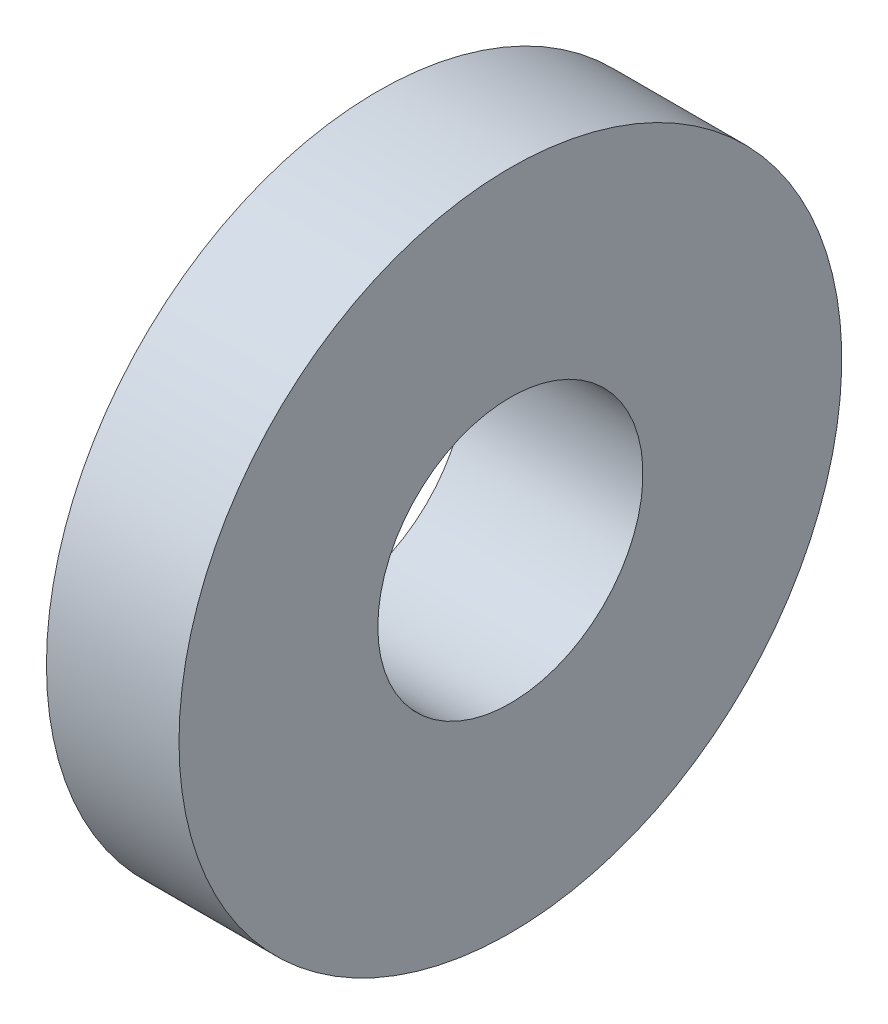
from build123d import *

# Parameters (mm, degrees)
SKETCH2_R          = 1.5
CUT_EXTRUDE1_DEPTH = 10


with BuildPart() as part:
    # Sketch1 → Revolve1 (revolve)
    with BuildSketch(Plane.XY, mode=Mode.PRIVATE) as revolve1_sk:
        Polygon((0, 0), (0, 2.5), (0.5, 2.5), (0.5, 3.75), (2, 3.75), (2, 0), align=None)
    revolve(revolve1_sk.sketch.rotate(Axis((0, 0, 0), (1, 0, 0)), 90), axis=Axis((0, 0, 0), (1, 0, 0)))

    # Sketch2 → Cut-Extrude1 (cut)
    with BuildSketch(Plane.ZY):
        Circle(SKETCH2_R)
    extrude(amount=-CUT_EXTRUDE1_DEPTH, mode=Mode.SUBTRACT)


solid = part.part
